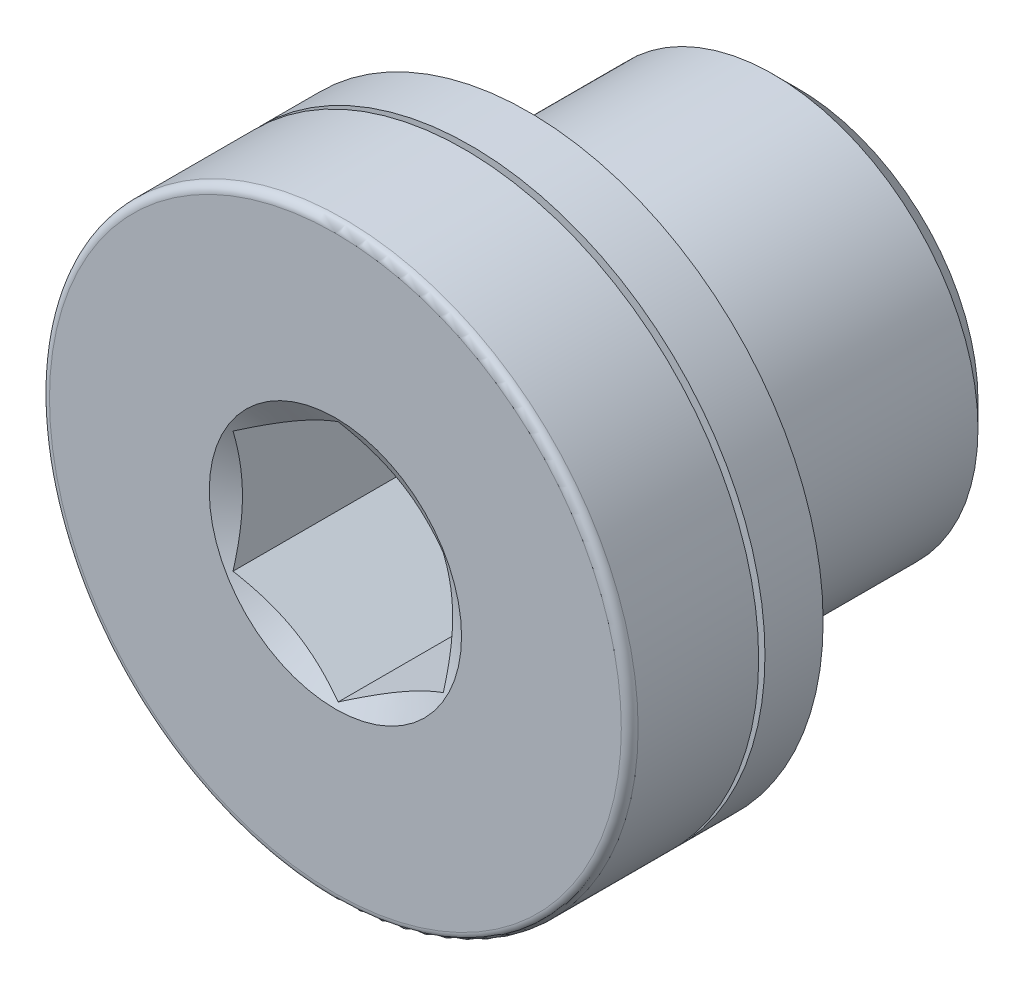
from build123d import *

# Parameters (mm, degrees)
CUT_EXTRUDE1_DEPTH = 4.6


with BuildPart() as part:
    # Sketch1 → Revolve1 (revolve)
    with BuildSketch(Plane(origin=(0, 0, 0), x_dir=(0, 0, -1), z_dir=(1, 0, 0)), mode=Mode.PRIVATE) as revolve1_sk:
        with BuildLine():
            Line((-2.867949192, 0), (-4.6, 3))
            Line((-4.6, 3), (-4.6, 6.8))
            ThreePointArc((-4.6, 6.8), (-4.541421356, 6.941421356), (-4.4, 7))
            Line((-4.4, 7), (-1.533333333, 7))
            Line((-1.533333333, 7), (-1.533333333, 6.3))
            Line((-1.533333333, 6.3), (-1.383333333, 6.3))
            Line((-1.383333333, 6.3), (-1.383333333, 7))
            Line((-1.383333333, 7), (0, 7))
            Line((0, 7), (0, 4.283))
            Line((0, 4.283), (0.581, 4.864))
            Line((0.581, 4.864), (5.819, 4.864))
            Line((5.819, 4.864), (6.4, 4.283))
            Line((6.4, 4.283), (6.4, 0))
            Line((6.4, 0), (-2.867949192, 0))
        make_face()
    revolve(revolve1_sk.sketch.rotate(Axis((0, 0, -6.4), (0, 0, 1)), 270), axis=Axis((0, 0, -6.4), (0, 0, 1)))

    # Sketch2 → Cut-Extrude1 (cut)
    with BuildSketch(Plane.XY.offset(4.6)):
        Polygon((-2.5, -1.443375673), (0, -2.886751346), (2.5, -1.443375673), (2.5, 1.443375673), (0, 2.886751346), (-2.5, 1.443375673), align=None)
    extrude(amount=-CUT_EXTRUDE1_DEPTH, mode=Mode.SUBTRACT)


solid = part.part
